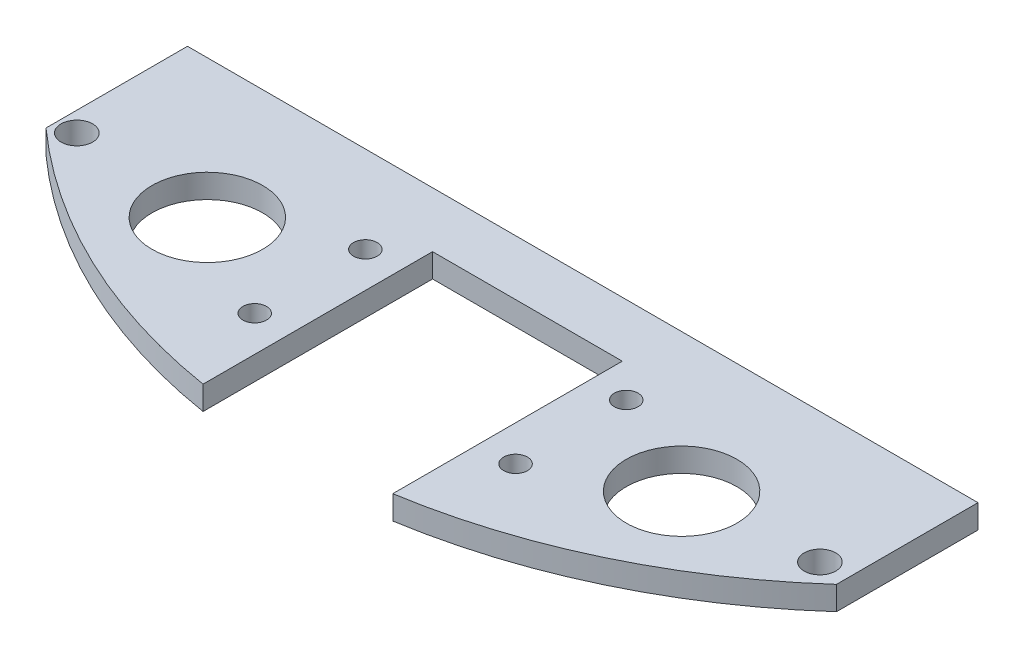
from build123d import *

# Parameters (mm, degrees)
CROQUIS1_R              = 75
SALIENTE_EXTRUIR1_DEPTH = 3
CROQUIS4_W              = 35
CROQUIS4_H              = 23
CORTAR_EXTRUIR9_DEPTH   = 107.108435103
CROQUIS5_W              = 31
CROQUIS5_H              = 56
CROQUIS5_W_2            = 25
CORTAR_EXTRUIR10_DEPTH  = 107.108435103
CROQUIS6_W              = 29.5
CROQUIS6_H              = 35
CORTAR_EXTRUIR11_DEPTH  = 91.188691087
CROQUIS7_R              = 1.59
CORTAR_EXTRUIR12_DEPTH  = 91.188691087
CORTAR_EXTRUIR13_DEPTH  = 91.188691087
CROQUIS9_R              = 7
CROQUIS9_R_2            = 2
CORTAR_EXTRUIR15_DEPTH  = 90.38679992
CROQUIS10_W             = 100
CROQUIS10_H             = 10
CROQUIS10_R             = 2
SALIENTE_EXTRUIR2_DEPTH = 3
CROQUIS11_R             = 1.5
CORTAR_EXTRUIR16_DEPTH  = 90.38679992
CROQUIS12_W             = 100
CROQUIS12_H             = 103
CORTAR_EXTRUIR17_DEPTH  = 90.38679992


with BuildPart() as part:
    # Croquis1 → Saliente-Extruir1 (new body)
    with BuildSketch(Plane(origin=(0, 0, 0), x_dir=(1, 0, 0), z_dir=(0, 1, 0))):
        with Locations(Location((0, 0, 0), (0, 0, 270))):
            Circle(CROQUIS1_R)
    extrude(amount=SALIENTE_EXTRUIR1_DEPTH)

    # Croquis4 → Cortar-Extruir9 (cut, through all)
    with BuildSketch(Plane(origin=(0, 3, 0), x_dir=(1, 0, 0), z_dir=(0, 1, 0))):
        with Locations((0, -18.5)):
            Rectangle(CROQUIS4_W, CROQUIS4_H)
    extrude(amount=-CORTAR_EXTRUIR9_DEPTH, mode=Mode.SUBTRACT)

    # Croquis5 → Cortar-Extruir10 (cut, through all)
    with BuildSketch(Plane(origin=(0, 3, 0), x_dir=(1, 0, 0), z_dir=(0, 1, 0))):
        Polygon((-50, 55), (0, 55), (0, 77), (-53, 77), (-53, 55), align=None)
        Polygon((0, 77), (0, 55), (50, 55), (53, 55), (53, 77), align=None)
        Polygon((-50, 0), (-50, 55), (-53, 55), (-81, 55), (-81, 0), align=None)
        Polygon((53, 55), (50, 55), (50, 0), (75, 0), (75, 55), align=None)
        with Locations((-65.5, -28)):
            Rectangle(CROQUIS5_W, CROQUIS5_H)
        with Locations((62.5, -28)):
            Rectangle(CROQUIS5_W_2, CROQUIS5_H)
    extrude(amount=-CORTAR_EXTRUIR10_DEPTH, mode=Mode.SUBTRACT)

    # Croquis6 → Cortar-Extruir11 (cut, through all)
    with BuildSketch(Plane(origin=(0, 3, 0), x_dir=(1, 0, 0), z_dir=(0, 1, 0))):
        with Locations((-35.25, -20.5)):
            Rectangle(CROQUIS6_W, CROQUIS6_H)
        with Locations((35.25, -20.5)):
            Rectangle(CROQUIS6_W, CROQUIS6_H)
    extrude(amount=-CORTAR_EXTRUIR11_DEPTH, mode=Mode.SUBTRACT)

    # Croquis7 → Cortar-Extruir12 (cut, through all)
    with BuildSketch(Plane(origin=(0, 3, 0), x_dir=(1, 0, 0), z_dir=(0, 1, 0))):
        with Locations(Location((-46.52, 47.87, 0), (0, 0, 270))):
            Circle(CROQUIS7_R)
        with Locations(Location((-40.17, -0.46, 0), (0, 0, 270))):
            Circle(CROQUIS7_R)
        with Locations(Location((36.03, 47.8, 0), (0, 0, 270))):
            Circle(CROQUIS7_R)
        with Locations(Location((34.76, -0.46, 0), (0, 0, 270))):
            Circle(CROQUIS7_R)
    extrude(amount=-CORTAR_EXTRUIR12_DEPTH, mode=Mode.SUBTRACT)

    # Croquis8 → Cortar-Extruir13 (cut, through all)
    with BuildSketch(Plane(origin=(0, 3, 0), x_dir=(1, 0, 0), z_dir=(0, 1, 0))):
        with BuildLine():
            ThreePointArc((-12, -74.033776076), (-6.019418341, -74.758053766), (0, -75))
            Line((0, -75), (0, -45))
            Line((0, -45), (-12, -45))
            Line((-12, -45), (-12, -74.033776076))
        make_face()
        with BuildLine():
            Line((0, -45), (0, -75))
            ThreePointArc((0, -75), (6.019418341, -74.758053766), (12, -74.033776076))
            Line((12, -74.033776076), (12, -45))
            Line((12, -45), (0, -45))
        make_face()
    extrude(amount=-CORTAR_EXTRUIR13_DEPTH, mode=Mode.SUBTRACT)

    # Croquis9 → Cortar-Extruir15 (cut, through all)
    with BuildSketch(Plane(origin=(0, 3, 0), x_dir=(1, 0, 0), z_dir=(0, 1, 0))):
        with Locations(Location((-30, -55.493776076, 0), (0, 0, 270))):
            Circle(CROQUIS9_R)
        with Locations(Location((30, -55.493776076, 0), (0, 0, 90))):
            Circle(CROQUIS9_R)
        with Locations(Location((-47.5, -54.5, 0), (0, 0, 270))):
            Circle(CROQUIS9_R_2)
        with Locations(Location((46.5, -54.5, 0), (0, 0, 270))):
            Circle(CROQUIS9_R_2)
    extrude(amount=-CORTAR_EXTRUIR15_DEPTH, mode=Mode.SUBTRACT)

    # Croquis10 → Saliente-Extruir2 (add)
    with BuildSketch(Plane(origin=(0, 3, 0), x_dir=(1, 0, 0), z_dir=(0, 1, 0))):
        with Locations((0, 60)):
            Rectangle(CROQUIS10_W, CROQUIS10_H)
        with Locations(Location((-45, 60, 0), (0, 0, 270))):
            Circle(CROQUIS10_R, mode=Mode.SUBTRACT)
        with Locations(Location((45, 60, 0), (0, 0, 270))):
            Circle(CROQUIS10_R, mode=Mode.SUBTRACT)
    extrude(amount=-SALIENTE_EXTRUIR2_DEPTH)

    # Croquis11 → Cortar-Extruir16 (cut, through all)
    with BuildSketch(Plane(origin=(0, 3, 0), x_dir=(1, 0, 0), z_dir=(0, 1, 0))):
        with Locations(Location((-16.5, -49, 0), (0, 0, 270))):
            Circle(CROQUIS11_R)
        with Locations(Location((-16.5, -63, 0), (0, 0, 270))):
            Circle(CROQUIS11_R)
        with Locations(Location((16.5, -63, 0), (0, 0, 90))):
            Circle(CROQUIS11_R)
        with Locations(Location((16.5, -49, 0), (0, 0, 90))):
            Circle(CROQUIS11_R)
    extrude(amount=-CORTAR_EXTRUIR16_DEPTH, mode=Mode.SUBTRACT)

    # Croquis12 → Cortar-Extruir17 (cut, through all)
    with BuildSketch(Plane(origin=(0, 3, 0), x_dir=(1, 0, 0), z_dir=(0, 1, 0))):
        with Locations((0, 13.5)):
            Rectangle(CROQUIS12_W, CROQUIS12_H)
    extrude(amount=-CORTAR_EXTRUIR17_DEPTH, mode=Mode.SUBTRACT)


solid = part.part
